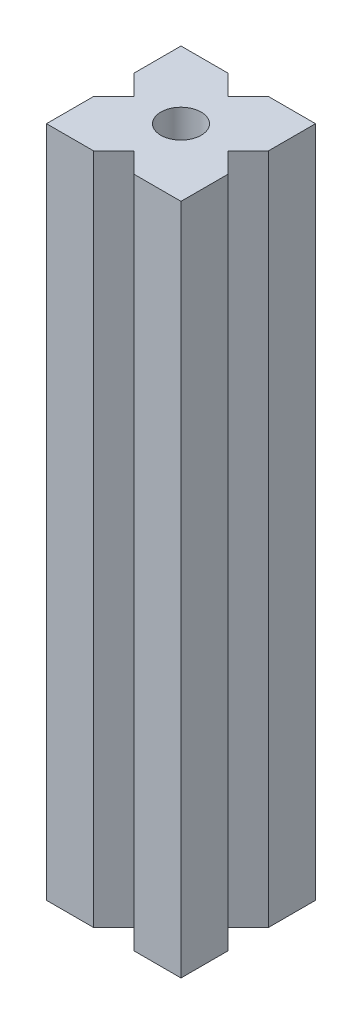
from build123d import *

# Parameters (mm, degrees)
SKIZZE1_W                       = 20
SKIZZE1_H                       = 20
AUFSATZ_LINEAR_AUSTRAGEN1_DEPTH = 100
SCHNITT_LINEAR_AUSTRAGEN1_DEPTH = 104.923048454
SKETCH1_R                       = 3
EXTRUDE1_DEPTH                  = 104.923048454


with BuildPart() as part:
    # Skizze1 → Aufsatz-Linear austragen1 (new body)
    with BuildSketch(Plane(origin=(0, 0, 0), x_dir=(1, 0, 0), z_dir=(0, 1, 0))):
        with Locations((10, 10)):
            Rectangle(SKIZZE1_W, SKIZZE1_H)
    extrude(amount=AUFSATZ_LINEAR_AUSTRAGEN1_DEPTH)

    # Skizze2 → Schnitt-Linear austragen1 (cut, through all)
    with BuildSketch(Plane(origin=(0, 100, 0), x_dir=(1, 0, 0), z_dir=(0, 1, 0))):
        Polygon((7, 20), (10, 17), (13, 20), align=None)
        Polygon((20, 13), (17, 10), (20, 7), align=None)
        Polygon((0, 7), (0, 13), (3, 10), align=None)
        Polygon((7, 0), (13, 0), (10, 3), align=None)
    extrude(amount=-SCHNITT_LINEAR_AUSTRAGEN1_DEPTH, mode=Mode.SUBTRACT)

    # Sketch1 → Extrude1 (cut, through all)
    with BuildSketch(Plane(origin=(0, 100, 0), x_dir=(1, 0, 0), z_dir=(0, 1, 0))):
        with Locations(Location((10, 10, 0), (0, 0, 270))):
            Circle(SKETCH1_R)
    extrude(amount=-EXTRUDE1_DEPTH, mode=Mode.SUBTRACT)


solid = part.part
